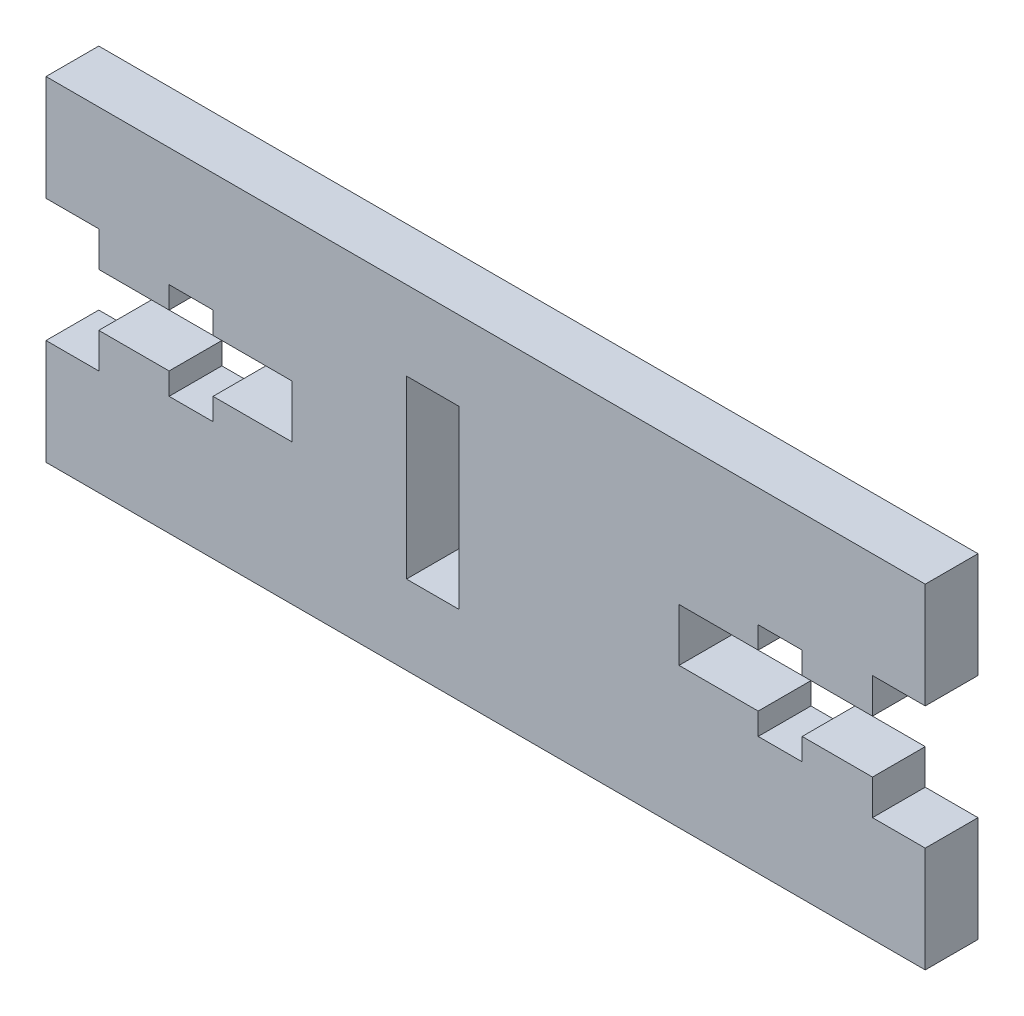
from build123d import *

# Parameters (mm, degrees)
SKETCH_1_W      = 2.9999
SKETCH_1_H      = 9.999
EXTRUDE_1_DEPTH = 3


with BuildPart() as part:
    # 草图1 → 凸台-拉伸1 (new body)
    with BuildSketch(Plane.XY.offset(3)):
        Polygon((42.580009157, 5.99999), (42.580009157, 7.99949), (38.581009157, 7.99949), (38.581009157, 6.74959), (36.079809157, 6.74959), (36.079809157, 7.99949), (31.580009157, 7.99949), (31.580009157, 10.99949), (36.079809157, 10.99949), (36.079809157, 12.25079), (38.581009157, 12.25079), (38.581009157, 10.99949), (42.580009157, 10.99949), (42.580009157, 13.00039), (45.579909157, 13.00039), (45.579909157, 19.000390002), (-4.419390843, 19.000390002), (-4.419390843, 13.00039), (-1.419350843, 13.00039), (-1.419350843, 10.99949), (2.579649157, 10.99949), (2.579649157, 12.25079), (5.080849157, 12.25079), (5.080849157, 10.99949), (9.580649157, 10.99949), (9.580649157, 7.99949), (5.080849157, 7.99949), (5.080849157, 6.74959), (2.579649157, 6.74959), (2.579649157, 7.99949), (-1.419350843, 7.99949), (-1.419350843, 5.99999), (-4.419250843, 5.99999), (-4.419250843, -2e-09), (45.580189157, -2e-09), (45.580189157, 5.99999), align=None)
        with Locations((17.580299157, 9.50019)):
            Rectangle(SKETCH_1_W, SKETCH_1_H, mode=Mode.SUBTRACT)
    extrude(amount=-EXTRUDE_1_DEPTH)


solid = part.part
